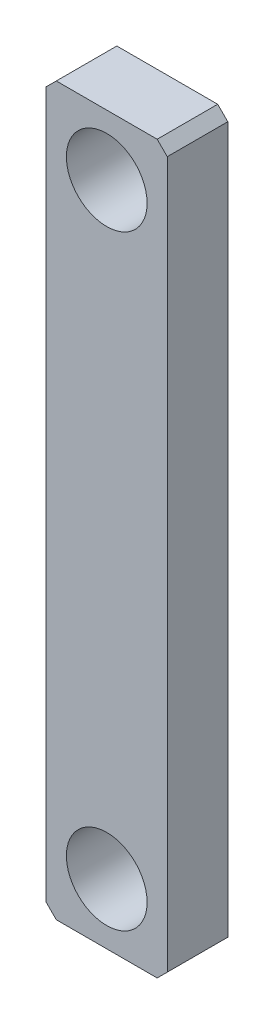
from build123d import *

# Parameters (mm, degrees)
SKETCH_1_W          = 12
SKETCH_1_H          = 72
EXTRUDE_1_DEPTH     = 6
SKETCH_2_R          = 4
CUT_EXTRUDE_1_DEPTH = 74.239333694
SKETCH_3_R          = 4
CUT_EXTRUDE_2_DEPTH = 74.239333694
CHAMFER_1_SIZE      = 1


with BuildPart() as part:
    # ｽｹｯﾁ1 → ﾎﾞｽ - 押し出し1 (new body)
    with BuildSketch(Plane.XY):
        with Locations((6, 36)):
            Rectangle(SKETCH_1_W, SKETCH_1_H)
    extrude(amount=EXTRUDE_1_DEPTH)

    # ｽｹｯﾁ2 → ｶｯﾄ - 押し出し1 (cut, through all)
    with BuildSketch(Plane.XY.offset(6)):
        with Locations((6, 66)):
            Circle(SKETCH_2_R)
    extrude(amount=-CUT_EXTRUDE_1_DEPTH, mode=Mode.SUBTRACT)

    # ｽｹｯﾁ3 → ｶｯﾄ - 押し出し2 (cut, through all)
    with BuildSketch(Plane.XY.offset(6)):
        with Locations((6, 6)):
            Circle(SKETCH_3_R)
    extrude(amount=-CUT_EXTRUDE_2_DEPTH, mode=Mode.SUBTRACT)

    # 面取り1
    chamfer_1_edges = [part.edges().sort_by_distance(p)[0] for p in [
        (0, 72, 3),
        (12, 72, 3),
        (12, 0, 3),
        (0, 0, 3),
    ]]
    chamfer(chamfer_1_edges, length=CHAMFER_1_SIZE)


solid = part.part
